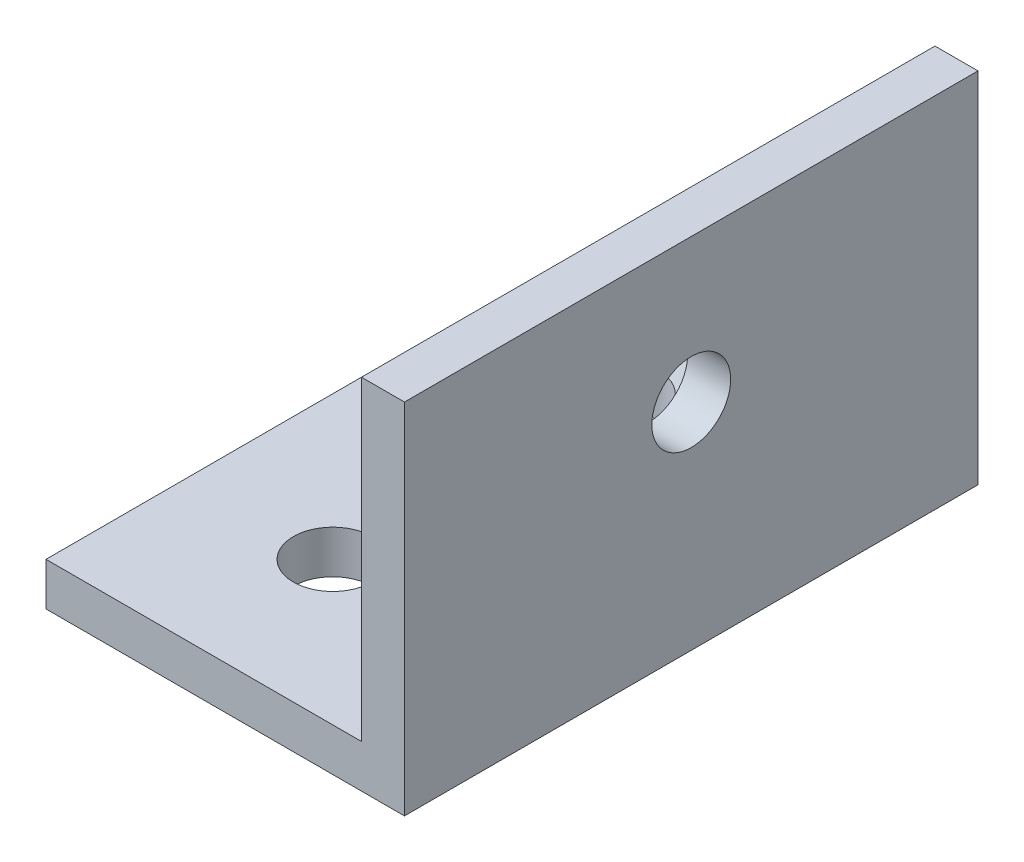
from build123d import *

# Parameters (mm, degrees)
BOSS_EXTRUDE1_DEPTH        = 40
SKETCH2_R                  = 2.75
CUT_EXTRUDE1_DEPTH         = 53.048054719
F_5_0_5_5_DIAMETER_HOLE1_D = 5.5


with BuildPart() as part:
    # Sketch1 → Boss-Extrude1 (new body)
    with BuildSketch(Plane.XY):
        Polygon((0, 0), (0, 25), (-3, 25), (-3, 3), (-25, 3), (-25, 0), align=None)
    extrude(amount=BOSS_EXTRUDE1_DEPTH)

    # Sketch2 → Cut-Extrude1 (cut, through all)
    with BuildSketch(Plane(origin=(0, 3, 0), x_dir=(1, 0, 0), z_dir=(0, 1, 0))):
        with Locations(Location((-15, -10, 0), (0, 0, 180))):
            Circle(SKETCH2_R)
        with Locations((-15, -30)):
            Circle(SKETCH2_R)
    extrude(amount=-CUT_EXTRUDE1_DEPTH, mode=Mode.SUBTRACT)

    # Ø5.0 (5.5) Diameter Hole1 (through all)
    with Locations(Plane.ZY.offset(3)):
        with Locations((20, 15)):
            Hole(F_5_0_5_5_DIAMETER_HOLE1_D / 2)


solid = part.part
